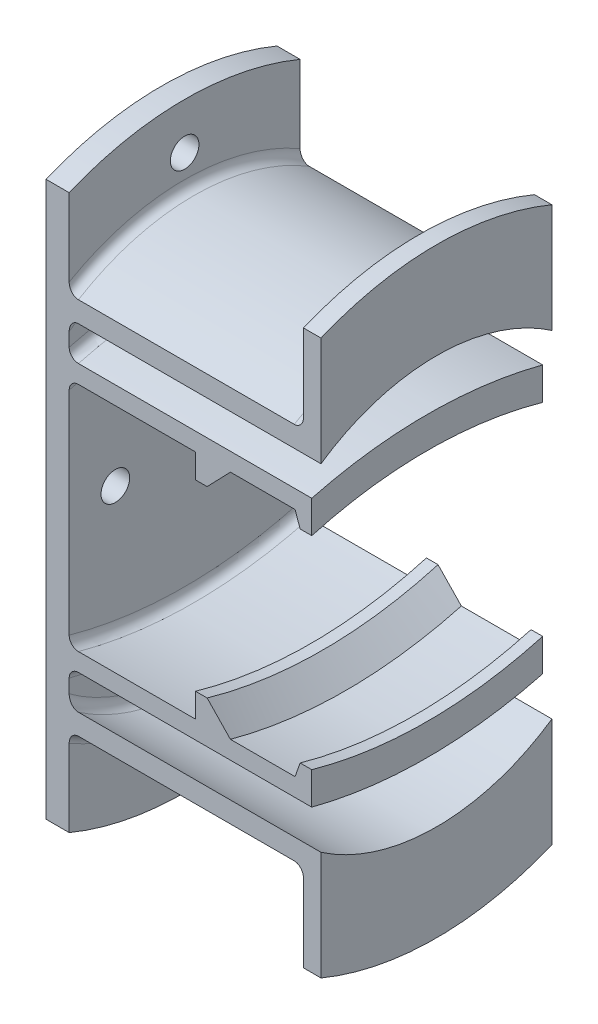
from build123d import *

# Parameters (mm, degrees)
SKETCH2_OUTSIDE_W           = 163.676
SKETCH2_OUTSIDE_H           = 163.676
SKETCH2_OUTSIDE_W_2         = 31.75
SKETCH2_OUTSIDE_H_2         = 36.068
CUT_EXTRUDE1_DEPTH          = 143.862884438
FILLET1_R                   = 1.27
FILLET2_R                   = 2.54
RINGCUT_EXTRUDE3_DEPTH      = 81.964552311
RINGCUT_EXTRUDE3_DEPTH_BACK = 81.964552311
SKETCH6_OUTSIDE_W           = 109.092
SKETCH6_OUTSIDE_H           = 109.092
SKETCH4_R                   = 1.9685
CUT_EXTRUDE2_DEPTH          = 71.484874378
RINGFILLET4_R               = 1.27
SKETCH7_R                   = 1.9685
CUT_EXTRUDE4_DEPTH          = 71.484874378


with BuildPart() as part:
    # Sketch1 → Revolve1 (revolve)
    with BuildSketch(Plane.XY, mode=Mode.PRIVATE) as revolve1_sk:
        Polygon((0, 0), (0.693363296, -1.905), (2.293363296, -1.905), (2.293363296, 2.4), (-34.231636704, 2.4), (-34.231636704, -60.325), (-31.056636704, -60.325), (-31.056636704, 0), (-13.69, 0), (-13.69, -3.2), (-12.09, -3.2), (-8.89, 0), align=None)
    revolve(revolve1_sk.sketch.rotate(Axis((-31.056636704, -60.325, 0), (-1, 0, 0)), 90), axis=Axis((-31.056636704, -60.325, 0), (-1, 0, 0)))

    # Sketch2 outside → Cut-Extrude1 (cut, through all)
    with BuildSketch(Plane(origin=(2.293363296, 0, 0), x_dir=(0, 0, -1), z_dir=(1, 0, 0))):
        with Locations((0, -60.325)):
            Rectangle(SKETCH2_OUTSIDE_W, SKETCH2_OUTSIDE_H)
        Rectangle(SKETCH2_OUTSIDE_W_2, SKETCH2_OUTSIDE_H_2, mode=Mode.SUBTRACT)
    extrude(amount=-CUT_EXTRUDE1_DEPTH, mode=Mode.SUBTRACT)

    # Fillet1
    fillet1_edges = [part.edges().sort_by_distance(p)[0] for p in [
        (-31.056636704, 0, 0),
    ]]
    fillet(fillet1_edges, radius=FILLET1_R)

    # Fillet2
    fillet2_edges = [part.edges().sort_by_distance(p)[0] for p in [
        (-34.231636704, 2.4, 0),
    ]]
    fillet(fillet2_edges, radius=FILLET2_R)

    # Sketch5 → RingRevolve2 (revolve)
    with BuildSketch(Plane.XY, mode=Mode.PRIVATE) as ringrevolve2_sk:
        Polygon((-31.056636704, -3.443742982), (-31.056636704, 10.02), (3.563363296, 10.02), (3.563363296, 23.241), (1.163363296, 23.241), (1.163363296, 12.42), (-31.056636704, 12.42), (-31.056636704, 23.241), (-34.231636704, 23.241), (-34.231636704, 11.15), (-34.231636704, -3.443742982), align=None)
    revolve(ringrevolve2_sk.sketch.rotate(Axis((-34.231636704, -18.034, 0), (1, 0, 0)), 90), axis=Axis((-34.231636704, -18.034, 0), (1, 0, 0)))

    # Sketch6 outside → RingCut-Extrude3 (cut, two sides: drawn at the far end of the back side and taken through both)
    with BuildSketch(Plane(origin=(2.293363296, 0, 0), x_dir=(0, 0, -1), z_dir=(1, 0, 0)).offset(-RINGCUT_EXTRUDE3_DEPTH_BACK)):
        with Locations((0, -18.034)):
            Rectangle(SKETCH6_OUTSIDE_W, SKETCH6_OUTSIDE_H)
        Polygon((-15.875, 0.357864138), (-15.875, -18.034), (15.875, -18.034), (15.875, 0.357864138), (15.875, 24.013762752), (-15.875, 24.013762752), align=None, mode=Mode.SUBTRACT)
    extrude(amount=RINGCUT_EXTRUDE3_DEPTH + RINGCUT_EXTRUDE3_DEPTH_BACK, mode=Mode.SUBTRACT)

    # Mirror1: part across plane


with BuildPart() as part_1:
    add(part.part)
    add(part.part.mirror(Plane(origin=(-34.231636704, -18.034, 15.875), x_dir=(0, 0, 1), z_dir=(0, -1, 0))))

    # Sketch4 → Cut-Extrude2 (cut, through all)
    with BuildSketch(Plane(origin=(-31.056636704, 0, 0), x_dir=(0, 0, -1), z_dir=(1, 0, 0))):
        with Locations((-9.525, -18.034)):
            Circle(SKETCH4_R)
        with Locations((9.525, -18.034)):
            Circle(SKETCH4_R)
    extrude(amount=-CUT_EXTRUDE2_DEPTH, mode=Mode.SUBTRACT)

    # RingFillet4
    ringfillet4_edges = [part_1.edges().sort_by_distance(p)[0] for p in [
        (-31.056636704, -38.468, 0),
        (-31.056636704, -46.088, 0),
        (1.163363296, -48.488, 0),
        (-31.056636704, -48.488, 0),
        (-31.056636704, 2.4, 0),
        (-31.056636704, 10.02, 0),
        (1.163363296, 12.42, 0),
        (-31.056636704, 12.42, 0),
    ]]
    fillet(ringfillet4_edges, radius=RINGFILLET4_R)

    # Sketch7 → Cut-Extrude4 (cut, through all)
    with BuildSketch(Plane(origin=(-31.056636704, 0, 0), x_dir=(0, 0, -1), z_dir=(1, 0, 0))):
        with Locations((0, 16.891)):
            Circle(SKETCH7_R)
        with Locations((0, -52.959)):
            Circle(SKETCH7_R)
    extrude(amount=-CUT_EXTRUDE4_DEPTH, mode=Mode.SUBTRACT)


solid = part_1.part
